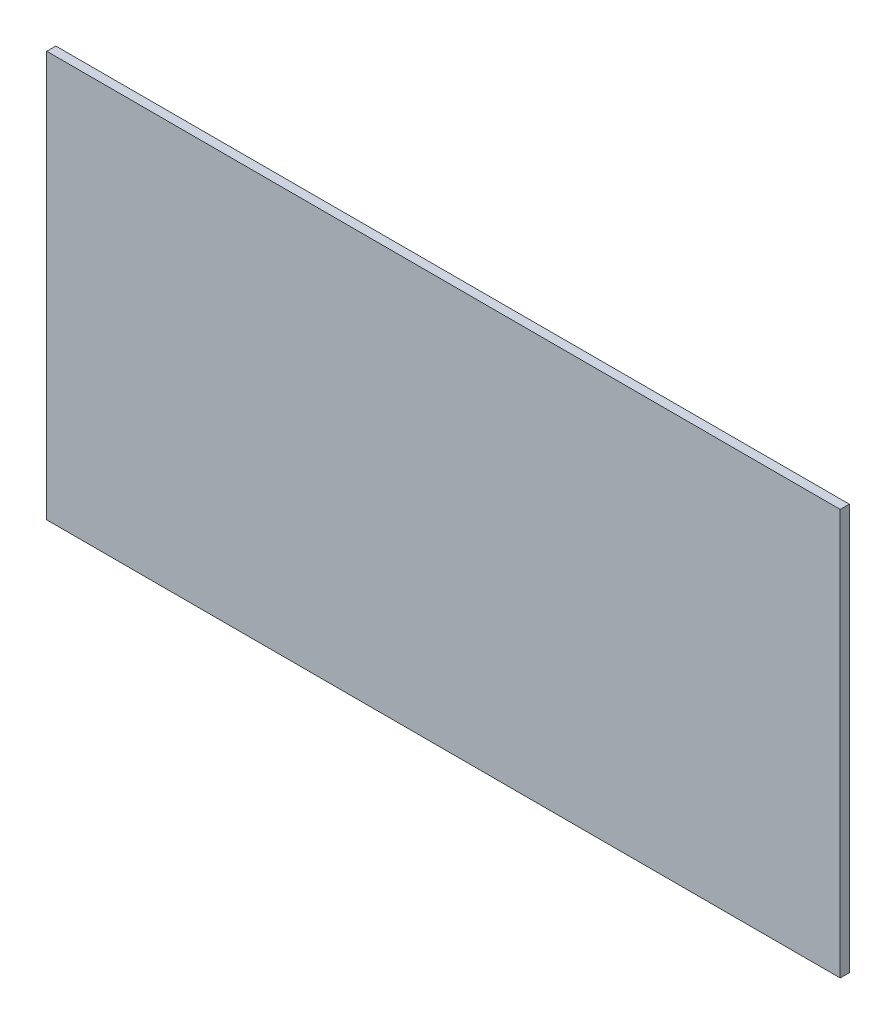
from build123d import *

# Parameters (mm, degrees)
ESBO_O1_W                = 131
ESBO_O1_H                = 67
RESSALTO_EXTRUS_O1_DEPTH = 1.5


with BuildPart() as part:
    # Esboço1 → Ressalto-extrusão1 (new body)
    with BuildSketch(Plane.XY):
        Rectangle(ESBO_O1_W, ESBO_O1_H)
    extrude(amount=RESSALTO_EXTRUS_O1_DEPTH)


solid = part.part
